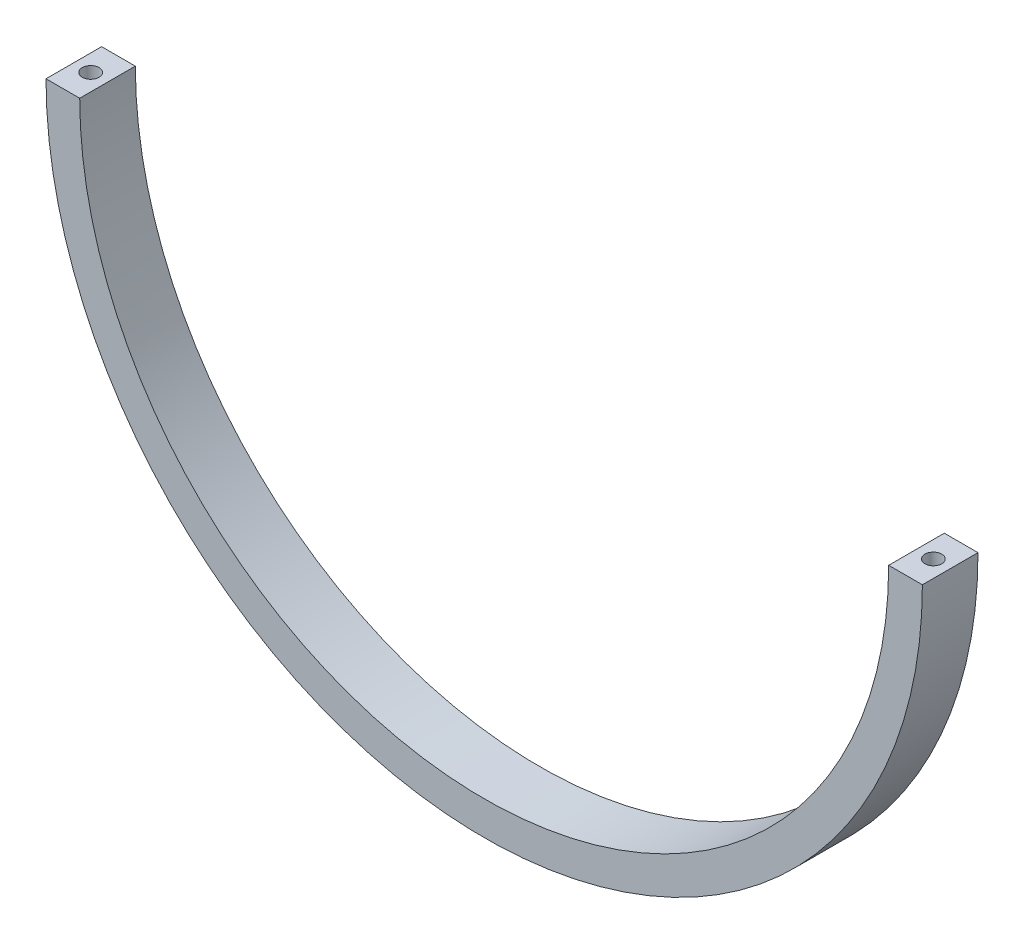
from build123d import *

# Parameters (mm, degrees)
BOSS_EXTRUDE1_DEPTH = 3.3
CUT_EXTRUDE1_DEPTH  = 3.3
SCALE1_SCALE        = 1.9329
SCALE2_SCALE        = 1.5


with BuildPart() as part:
    # Sketch1 → Boss-Extrude1 (new body)
    with BuildSketch(Plane.XY):
        with BuildLine():
            Line((-26, 0), (-24, 0))
            ThreePointArc((-24, 0), (0, -24), (24, 0))
            Line((24, 0), (26, 0))
            ThreePointArc((26, 0), (0, -26), (-26, 0))
        make_face()
    extrude(amount=BOSS_EXTRUDE1_DEPTH)

    # Sketch2 → Cut-Extrude1 (cut)
    with BuildSketch(Plane(origin=(0, 0, 0), x_dir=(1, 0, 0), z_dir=(0, 1, 0))):
        with BuildLine():
            ThreePointArc((24.5, -1.65), (25, -2.15), (25.5, -1.65))
            Line((25.5, -1.65), (24.5, -1.65))
        make_face()
        with BuildLine():
            Line((24.5, -1.65), (25.5, -1.65))
            ThreePointArc((25.5, -1.65), (25, -1.15), (24.5, -1.65))
        make_face()
        with BuildLine():
            ThreePointArc((-25.5, -1.65), (-25, -2.15), (-24.5, -1.65))
            Line((-24.5, -1.65), (-25.5, -1.65))
        make_face()
        with BuildLine():
            Line((-25.5, -1.65), (-24.5, -1.65))
            ThreePointArc((-24.5, -1.65), (-25, -1.15), (-25.5, -1.65))
        make_face()
    extrude(amount=-CUT_EXTRUDE1_DEPTH, mode=Mode.SUBTRACT)


with BuildPart() as part_1:
    # Scale1: scaled about (0, -16.068164215, 1.65)
    add(part.part.scale(SCALE1_SCALE).moved(Location((0, 14.989990396, -1.539285))))


with BuildPart() as part_2:
    # Scale2: scaled about (0, -16.068164215, 1.65)
    add(part_1.part.scale(SCALE2_SCALE).moved(Location((0, 8.034082107, -0.825))))


solid = part_2.part
